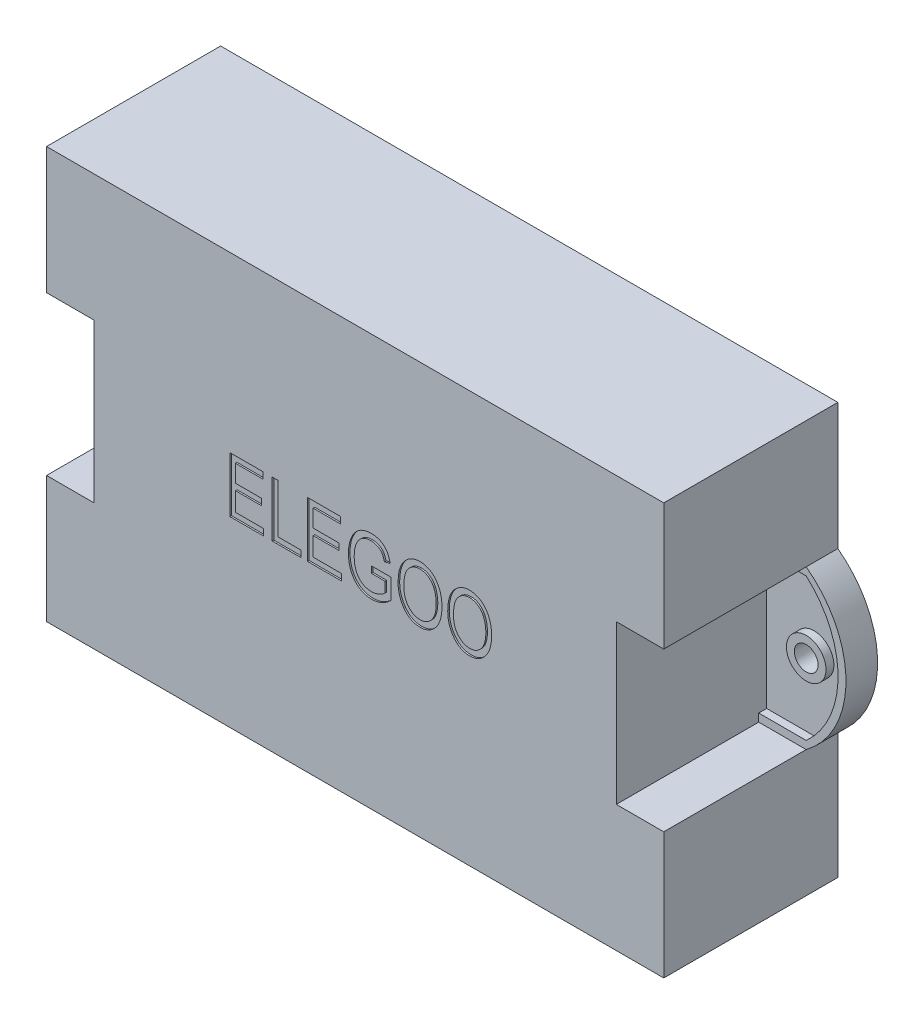
from build123d import *

# Parameters (mm, degrees)
BOSS_EXTRU_1_DEPTH      = 3
BOSS_EXTRU_2_DEPTH      = 19
ESQUISSE3_R             = 2.5
ESQUISSE3_R_2           = 1.5
BOSS_EXTRU_9_DEPTH      = 1
ENL_V_MAT_EXTRU_2_DEPTH = 0.2
ENL_V_START             = -10
ESQUISSE6_R             = 1.5
ENL_V_MAT_EXTRU_3_DEPTH = 10


with BuildPart() as part:
    # Esquisse1 → Boss.-Extru.1 (new body)
    with BuildSketch(Plane.XY):
        with BuildLine():
            Line((-2.21, 17.03), (36.79, 17.03))
            Line((36.79, 17.03), (36.79, 1.03))
            ThreePointArc((36.79, 1.03), (41.813713926, -8.97), (36.79, -18.97))
            Line((36.79, -18.97), (36.79, -34.97))
            Line((36.79, -34.97), (-2.21, -34.97))
            Line((-2.21, -34.97), (-2.21, 17.03))
        make_face()
    boss_extru_1 = extrude(amount=BOSS_EXTRU_1_DEPTH)

    # Esquisse2 → Boss.-Extru.2 (add)
    with BuildSketch(Plane.XY.offset(3)):
        Polygon((36.79, -18.97), (30.79, -18.97), (30.79, 1.03), (36.79, 1.03), (36.79, 17.03), (-2.21, 17.03), (-2.21, -34.97), (36.79, -34.97), align=None)
    boss_extru_2 = extrude(amount=BOSS_EXTRU_2_DEPTH)

    # Esquisse3 → Boss.-Extru.9 (add)
    # profile 1 of 4: a face of its own
    with BuildSketch(Plane.XY.offset(3)):
        with Locations(Location((36.79, -8.97, 0), (0, 0, 180))):
            Circle(ESQUISSE3_R)
        with Locations((36.79, -8.97)):
            Circle(ESQUISSE3_R_2, mode=Mode.SUBTRACT)
    # profile 2 of 4: a face of its own
    with BuildSketch(Plane.XY.offset(3)):
        with BuildLine():
            Line((36.787452184, 0.03), (36.79, 0.03))
            ThreePointArc((36.79, 0.03), (40.815412149, -8.97), (36.79, -17.97))
            ThreePointArc((36.79, -17.97), (36.165579804, -18.491619391), (35.507446563, -18.97))
            Line((35.507446563, -18.97), (36.79, -18.97))
            ThreePointArc((36.79, -18.97), (41.813713926, -8.97), (36.79, 1.03))
            Line((36.79, 1.03), (35.504415575, 1.03))
            ThreePointArc((35.504415575, 1.03), (36.162796738, 0.551635665), (36.787452184, 0.03))
        make_face()
    # profile 3 of 4: a face of its own
    with BuildSketch(Plane.XY.offset(3)):
        with BuildLine():
            Line((30.79, 0.03), (36.787452184, 0.03))
            ThreePointArc((36.787452184, 0.03), (36.162796738, 0.551635665), (35.504415575, 1.03))
            Line((35.504415575, 1.03), (30.79, 1.03))
            Line((30.79, 1.03), (30.79, 0.03))
        make_face()
    # profile 4 of 4: a face of its own
    with BuildSketch(Plane.XY.offset(3)):
        with BuildLine():
            ThreePointArc((35.507446563, -18.97), (36.165579804, -18.491619391), (36.79, -17.97))
            Line((36.79, -17.97), (30.79, -17.97))
            Line((30.79, -17.97), (30.79, -18.97))
            Line((30.79, -18.97), (35.507446563, -18.97))
        make_face()
    boss_extru_9 = extrude(amount=BOSS_EXTRU_9_DEPTH)

    # Symétrie6: Boss.-Extru.1, Boss.-Extru.2, Boss.-Extru.9 across plane
    add(boss_extru_1.mirror(Plane(origin=(-2.21, 17.03, 3), x_dir=(0, 0, 1), z_dir=(1, 0, 0))))
    add(boss_extru_2.mirror(Plane(origin=(-2.21, 17.03, 3), x_dir=(0, 0, 1), z_dir=(1, 0, 0))))
    add(boss_extru_9.mirror(Plane(origin=(-2.21, 17.03, 3), x_dir=(0, 0, 1), z_dir=(1, 0, 0))))

    # Esquisse5 → Enlèv. mat.-Extru.2 (cut)
    # profile 1 of 6: a face of its own
    with BuildSketch(Plane.XY.offset(22)):
        Polygon((-18.057289622, -11.88423704), (-18.057289622, -4.88423704), (-13.87547144, -4.88423704), (-13.87547144, -5.702418858), (-17.330016895, -5.702418858), (-17.330016895, -7.88423704), (-14.057289622, -7.88423704), (-14.057289622, -8.702418858), (-17.330016895, -8.702418858), (-17.330016895, -11.066055222), (-13.784562349, -11.066055222), (-13.784562349, -11.88423704), align=None)
    # profile 2 of 6: a face of its own
    with BuildSketch(Plane.XY.offset(22)):
        Polygon((-12.693653258, -11.88423704), (-12.693653258, -4.88423704), (-11.966380531, -4.88423704), (-11.966380531, -11.066055222), (-9.057289622, -11.066055222), (-9.057289622, -11.88423704), align=None)
    # profile 3 of 6: a face of its own
    with BuildSketch(Plane.XY.offset(22)):
        Polygon((-8.239107804, -11.88423704), (-8.239107804, -4.88423704), (-4.057289622, -4.88423704), (-4.057289622, -5.702418858), (-7.511835076, -5.702418858), (-7.511835076, -7.88423704), (-4.239107804, -7.88423704), (-4.239107804, -8.702418858), (-7.511835076, -8.702418858), (-7.511835076, -11.066055222), (-3.966380531, -11.066055222), (-3.966380531, -11.88423704), align=None)
    # profile 4 of 6: a face of its own
    with BuildSketch(Plane.XY.offset(22)):
        with BuildLine():
            Line((-0.148198713, -9.156964313), (-0.148198713, -8.338782495))
            Line((-0.148198713, -8.338782495), (2.306346742, -8.338782495))
            Line((2.306346742, -8.338782495), (2.306346742, -10.902702949))
            add(Edge.make_bspline(
                [(2.306346742, -10.902702949), (2.21300257, -10.987643456), (2.030313115, -11.153885596), (1.739146432, -11.370934521), (1.444357993, -11.557504236), (1.14436216, -11.709936828), (0.839698561, -11.829659821), (0.53056013, -11.913252649), (0.216713464, -11.96511629), (0.00587935, -11.971795131), (-0.099903258, -11.975146131)],
                knots=[0, 0, 0, 0, 1.121144615, 2.194259096, 3.22291754, 4.218514423, 5.180530362, 6.126881594, 7.060193117, 8, 8, 8, 8], degree=3))
            add(Edge.make_bspline(
                [(-0.099903258, -11.975146131), (-0.169536272, -11.973527736), (-0.307619034, -11.970318447), (-0.511864163, -11.952454353), (-0.710575738, -11.919079502), (-0.90334636, -11.873994202), (-1.090762489, -11.815972159), (-1.271184033, -11.742120304), (-1.447977622, -11.659583386), (-1.616998008, -11.560738038), (-1.778874063, -11.450128655), (-1.932538272, -11.32748953), (-2.078294042, -11.194071551), (-2.213497034, -11.046313577), (-2.340623064, -10.887499989), (-2.461282027, -10.718166162), (-2.569962832, -10.534819607), (-2.672745007, -10.341247482), (-2.763098293, -10.135595145), (-2.841610997, -9.919633851), (-2.907954727, -9.693704494), (-2.963609183, -9.457675354), (-3.006126384, -9.211471751), (-3.035147093, -8.955334293), (-3.054583881, -8.68946208), (-3.056377381, -8.50879928), (-3.057289622, -8.416907495)],
                knots=[0, 0, 0, 0, 0.963545397, 1.910717405, 2.833679837, 3.748938136, 4.648160849, 5.544707014, 6.44428759, 7.345417256, 8.250301349, 9.15471106, 10.063381295, 10.981308332, 11.922549023, 12.876762963, 13.855312354, 14.869185747, 15.907484256, 16.960251447, 18.046404778, 19.163470092, 20.313696906, 21.500864286, 22.728847097, 24, 24, 24, 24], degree=3))
            add(Edge.make_bspline(
                [(-3.057289622, -8.416907495), (-3.0563389, -8.323599773), (-3.054469284, -8.140108021), (-3.03552937, -7.86939845), (-3.004410478, -7.608229214), (-2.96155843, -7.356080422), (-2.908563947, -7.112305664), (-2.839727493, -6.878381683), (-2.76054674, -6.653391579), (-2.669185543, -6.438861868), (-2.56938221, -6.234986611), (-2.459628052, -6.044654666), (-2.343583151, -5.867294916), (-2.217577539, -5.705820135), (-2.087469543, -5.555138715), (-1.947683014, -5.420344366), (-1.801026771, -5.298408246), (-1.64537749, -5.192115003), (-1.483115941, -5.097817818), (-1.313193804, -5.017007743), (-1.136877019, -4.947053657), (-0.953274377, -4.889772592), (-0.762006493, -4.847906826), (-0.563754366, -4.816795561), (-0.358403504, -4.795764411), (-0.218800545, -4.794146288), (-0.148198713, -4.793327949)],
                knots=[0, 0, 0, 0, 1.283121513, 2.523287582, 3.730023389, 4.899079804, 6.039789461, 7.15880579, 8.250410031, 9.318392136, 10.363902253, 11.370311636, 12.338384822, 13.276198214, 14.185288112, 15.074093801, 15.943727649, 16.805327304, 17.663128848, 18.522362821, 19.39060582, 20.270106898, 21.164311373, 22.080741752, 23.02936765, 24, 24, 24, 24], degree=3))
            add(Edge.make_bspline(
                [(-0.148198713, -4.793327949), (-0.045283381, -4.795776313), (0.154920446, -4.800539177), (0.445181775, -4.84551072), (0.715918021, -4.918723992), (0.966092713, -5.023355588), (1.195751123, -5.154526409), (1.40483213, -5.310387596), (1.592759918, -5.490908465), (1.730187589, -5.662268133), (1.829793665, -5.812150157), (1.899797521, -5.935652101), (1.965023659, -6.068844112), (2.024292485, -6.212927103), (2.079596826, -6.36652883), (2.130926537, -6.529858713), (2.176116974, -6.703528333), (2.202126299, -6.823061155), (2.215437651, -6.88423704)],
                knots=[0, 0, 0, 0, 1.421442541, 2.765168547, 4.047841273, 5.288586259, 6.501956771, 7.694182091, 8.88353085, 10.093491299, 10.721426975, 11.369099503, 12.053886711, 12.769643166, 13.521004755, 14.309514717, 15.134823968, 16, 16, 16, 16], degree=3))
            Line((2.215437651, -6.88423704), (1.488164924, -7.066055222))
            add(Edge.make_bspline(
                [(1.488164924, -7.066055222), (1.46442036, -6.976640385), (1.419717269, -6.808302078), (1.336235163, -6.576358898), (1.243285071, -6.380220902), (1.13936397, -6.215815777), (1.019965564, -6.078957899), (0.887718056, -5.957837581), (0.735029327, -5.856586003), (0.569280307, -5.767495338), (0.388487805, -5.699052173), (0.197039457, -5.646895316), (-0.006160171, -5.617020224), (-0.14526217, -5.613373976), (-0.216380531, -5.611509767)],
                knots=[0, 0, 0, 0, 1.35370667, 2.548578037, 3.602482135, 4.525244969, 5.385205021, 6.25372376, 7.141792941, 8.059466754, 9.00287123, 9.96447941, 10.959304047, 12, 12, 12, 12], degree=3))
            add(Edge.make_bspline(
                [(-0.216380531, -5.611509767), (-0.268497866, -5.612192827), (-0.371041604, -5.613536786), (-0.522442663, -5.628221931), (-0.668121475, -5.652089702), (-0.80839528, -5.685420774), (-0.943641137, -5.725175032), (-1.071936795, -5.779325054), (-1.19562128, -5.839916976), (-1.314161536, -5.909761034), (-1.427227206, -5.989524761), (-1.533480115, -6.081039823), (-1.634825128, -6.181615545), (-1.728752777, -6.294446187), (-1.819826363, -6.415380582), (-1.903293487, -6.548470673), (-1.981905501, -6.691055418), (-2.053685104, -6.843945953), (-2.119514445, -7.006295157), (-2.17615102, -7.177554564), (-2.222441291, -7.358155359), (-2.263045902, -7.546521034), (-2.291518544, -7.744567756), (-2.315262325, -7.950982154), (-2.327491501, -8.166284158), (-2.3291665, -8.312728382), (-2.330016895, -8.387077949)],
                knots=[0, 0, 0, 0, 0.95244652, 1.873991161, 2.777557121, 3.648832578, 4.508552549, 5.350797697, 6.190771618, 7.02501797, 7.86316154, 8.7165405, 9.585620601, 10.469996113, 11.397859992, 12.351132043, 13.338946381, 14.372712626, 15.436726846, 16.539770861, 17.66713286, 18.84353329, 20.060284837, 21.322933361, 22.640856277, 24, 24, 24, 24], degree=3))
            add(Edge.make_bspline(
                [(-2.330016895, -8.387077949), (-2.328136817, -8.498886647), (-2.324489742, -8.715779215), (-2.295613566, -9.030379425), (-2.249941993, -9.324083371), (-2.183408028, -9.595945586), (-2.098226228, -9.846193615), (-1.994742529, -10.0752961), (-1.871065463, -10.282378689), (-1.728009263, -10.466590072), (-1.569888067, -10.6285446), (-1.400107307, -10.770162671), (-1.219087033, -10.89074088), (-1.025283979, -10.987195561), (-0.821542826, -11.065000369), (-0.605524153, -11.118715594), (-0.378287201, -11.150021741), (-0.223107845, -11.154618901), (-0.143937349, -11.156964313)],
                knots=[0, 0, 0, 0, 1.344305217, 2.607756079, 3.795613497, 4.915552292, 5.968887625, 6.970219091, 7.933010886, 8.862341374, 9.768284732, 10.649651063, 11.516609893, 12.377263757, 13.247581458, 14.134137142, 15.048060964, 16, 16, 16, 16], degree=3))
            add(Edge.make_bspline(
                [(-0.143937349, -11.156964313), (-0.066128414, -11.154509321), (0.091898038, -11.149523343), (0.329600595, -11.107887479), (0.5694829, -11.040213531), (0.80680626, -10.94896093), (1.033007404, -10.839870557), (1.240275478, -10.719879094), (1.422358248, -10.588001941), (1.527920826, -10.489019721), (1.579074014, -10.441055222)],
                knots=[0, 0, 0, 0, 0.978162575, 1.986604247, 3.025534994, 4.109442341, 5.180230685, 6.181206173, 7.118654505, 8, 8, 8, 8], degree=3))
            Line((1.579074014, -10.441055222), (1.579074014, -9.156964313))
            Line((1.579074014, -9.156964313), (-0.148198713, -9.156964313))
        make_face()
    # profile 5 of 6: a face of its own
    with BuildSketch(Plane.XY.offset(22)):
        with BuildLine():
            add(Edge.make_bspline(
                [(3.215437651, -8.476566586), (3.217910165, -8.333024977), (3.222725063, -8.053496509), (3.259427471, -7.647087379), (3.32177376, -7.266377491), (3.407401524, -6.911001388), (3.519907409, -6.581598076), (3.655946674, -6.276888697), (3.818456683, -5.998292282), (4.005061641, -5.747030271), (4.208615654, -5.522642534), (4.427731849, -5.328159251), (4.657796505, -5.161844052), (4.901661464, -5.028081377), (5.156186856, -4.920482762), (5.424931263, -4.8484657), (5.704710705, -4.800322072), (5.895628544, -4.795681021), (5.992426287, -4.793327949)],
                knots=[0, 0, 0, 0, 1.331070849, 2.592086014, 3.780305682, 4.906005075, 5.978011684, 7.003908552, 7.995748348, 8.962674125, 9.901370513, 10.800246893, 11.675154716, 12.528146756, 13.374603752, 14.231114787, 15.103152967, 16, 16, 16, 16], degree=3))
            add(Edge.make_bspline(
                [(5.992426287, -4.793327949), (6.055931242, -4.794734119), (6.181358621, -4.797511416), (6.367364305, -4.818425806), (6.549054767, -4.850037367), (6.726271246, -4.898131029), (6.899983232, -4.957212049), (7.068897623, -5.031321662), (7.23312986, -5.119033911), (7.39334884, -5.217560002), (7.547097983, -5.330296976), (7.693178739, -5.455315391), (7.831801207, -5.592102373), (7.960755104, -5.741739119), (8.082189124, -5.902803486), (8.194079601, -6.076407114), (8.297956483, -6.262116502), (8.394283406, -6.458686368), (8.480981619, -6.666290394), (8.556755662, -6.883819993), (8.618162206, -7.112049729), (8.671634336, -7.348742497), (8.710333861, -7.59610897), (8.740789359, -7.852349909), (8.757641931, -8.118857477), (8.759796242, -8.299461408), (8.760892196, -8.391339313)],
                knots=[0, 0, 0, 0, 0.899824171, 1.777224896, 2.649917024, 3.510973429, 4.376801712, 5.248254587, 6.121797682, 7.013780974, 7.911701495, 8.820786024, 9.736582303, 10.668970754, 11.617827344, 12.593151753, 13.593637019, 14.632021419, 15.69381936, 16.780371356, 17.893899404, 19.04171746, 20.217729733, 21.440466177, 22.69789874, 24, 24, 24, 24], degree=3))
            add(Edge.make_bspline(
                [(8.760892196, -8.391339313), (8.758606633, -8.516870889), (8.754131002, -8.762689009), (8.722175887, -9.12273036), (8.664064309, -9.464479795), (8.589349413, -9.789685079), (8.487601563, -10.095800646), (8.36510406, -10.384373709), (8.221399493, -10.656231282), (8.105418952, -10.82281822), (8.047824014, -10.905543858)],
                knots=[0, 0, 0, 0, 1.133525988, 2.219690354, 3.25996653, 4.261750254, 5.229810789, 6.168477289, 7.090481605, 8, 8, 8, 8], degree=3))
            add(Edge.make_bspline(
                [(8.047824014, -10.905543858), (7.981382963, -10.990370358), (7.851516031, -11.156173836), (7.630629117, -11.375395424), (7.394462766, -11.560518961), (7.143437467, -11.713989637), (6.875813992, -11.830226703), (6.59372064, -11.914873457), (6.295849476, -11.965449717), (6.092053395, -11.971872175), (5.988164924, -11.975146131)],
                knots=[0, 0, 0, 0, 1.070119256, 2.09167529, 3.083880958, 4.046692552, 5.007570185, 5.975302747, 6.967876608, 8, 8, 8, 8], degree=3))
            add(Edge.make_bspline(
                [(5.988164924, -11.975146131), (5.883788629, -11.971986493), (5.678943969, -11.965785517), (5.379084895, -11.913427747), (5.095447626, -11.826448021), (4.826501568, -11.706492901), (4.574980598, -11.549803969), (4.339519707, -11.35896551), (4.118621079, -11.134917034), (3.990059294, -10.96441839), (3.924244469, -10.877134767)],
                knots=[0, 0, 0, 0, 1.027712946, 2.016947528, 2.987811303, 3.944031492, 4.90967079, 5.89821231, 6.924028725, 8, 8, 8, 8], degree=3))
            add(Edge.make_bspline(
                [(3.924244469, -10.877134767), (3.86731085, -10.792852331), (3.75378061, -10.624786339), (3.610562642, -10.355017453), (3.487717265, -10.073632921), (3.388998265, -9.778613874), (3.309891613, -9.471675699), (3.25524643, -9.151462704), (3.222056267, -8.818179936), (3.217668335, -8.591701133), (3.215437651, -8.476566586)],
                knots=[0, 0, 0, 0, 0.958933014, 1.912189966, 2.876424288, 3.85247362, 4.843745406, 5.863745303, 6.913996742, 8, 8, 8, 8], degree=3))
        make_face()
        with BuildLine():
            add(Edge.make_bspline(
                [(3.942710378, -8.487930222), (3.944775287, -8.590730963), (3.948788789, -8.790541674), (3.975353752, -9.081692137), (4.022059781, -9.355252407), (4.087412702, -9.611196278), (4.168821969, -9.850273391), (4.272057335, -10.070279513), (4.393023092, -10.273305445), (4.532074511, -10.457740385), (4.685016557, -10.621232365), (4.845810859, -10.765280107), (5.016470893, -10.884574133), (5.192940154, -10.985715379), (5.379090544, -11.062988769), (5.573383008, -11.116433507), (5.775330002, -11.150442972), (5.912744566, -11.154768889), (5.982483105, -11.156964313)],
                knots=[0, 0, 0, 0, 1.312267352, 2.550614609, 3.728111592, 4.851026838, 5.919546711, 6.947055793, 7.94734328, 8.931337301, 9.889295514, 10.801324679, 11.681722049, 12.542374657, 13.393208477, 14.246700222, 15.110192087, 16, 16, 16, 16], degree=3))
            add(Edge.make_bspline(
                [(5.982483105, -11.156964313), (6.053627406, -11.154700048), (6.194305513, -11.150222775), (6.400788889, -11.117083459), (6.598397907, -11.061873973), (6.78604832, -10.98212466), (6.965564507, -10.882841852), (7.136071435, -10.76069969), (7.296960837, -10.615938391), (7.448983734, -10.450344835), (7.586634945, -10.262271003), (7.708461041, -10.053918691), (7.808997154, -9.823291044), (7.890411341, -9.572281953), (7.956663858, -9.301369927), (8.000084492, -9.00892723), (8.029957024, -8.696411033), (8.032375321, -8.480904646), (8.033619469, -8.370032495)],
                knots=[0, 0, 0, 0, 0.878770405, 1.737648083, 2.57658969, 3.407764765, 4.250999223, 5.106523145, 5.993164277, 6.920704469, 7.879005581, 8.867335561, 9.896730148, 10.980825599, 12.124467321, 13.338272289, 14.63061378, 16, 16, 16, 16], degree=3))
            add(Edge.make_bspline(
                [(8.033619469, -8.370032495), (8.03292533, -8.29709369), (8.031558207, -8.153438882), (8.016981213, -7.940562772), (7.99254381, -7.734028076), (7.961045616, -7.532584272), (7.915404349, -7.338391291), (7.865722432, -7.148427249), (7.802701782, -6.965246378), (7.753895209, -6.84660268), (7.729642196, -6.787646131)],
                knots=[0, 0, 0, 0, 1.078644903, 2.124418214, 3.153743212, 4.154196665, 5.137842886, 6.102739285, 7.057211248, 8, 8, 8, 8], degree=3))
            add(Edge.make_bspline(
                [(7.729642196, -6.787646131), (7.688660008, -6.701418159), (7.607673031, -6.531018699), (7.44209507, -6.302997209), (7.250424868, -6.099259803), (7.029134899, -5.928386812), (6.79037679, -5.786674968), (6.536251076, -5.684622649), (6.270480193, -5.622774709), (6.089341449, -5.615283055), (5.998108105, -5.611509767)],
                knots=[0, 0, 0, 0, 1.032714874, 2.040800129, 3.038924044, 4.055125724, 5.060150422, 6.038733642, 7.012177711, 8, 8, 8, 8], degree=3))
            add(Edge.make_bspline(
                [(5.998108105, -5.611509767), (5.925076468, -5.613772302), (5.781111754, -5.618232357), (5.570300552, -5.651107946), (5.369779269, -5.706923571), (5.179387267, -5.784542749), (4.997855357, -5.882244865), (4.82763148, -6.005123718), (4.666963545, -6.148712273), (4.5173841, -6.314731601), (4.379374553, -6.501871149), (4.264058392, -6.716748315), (4.162297166, -6.952402068), (4.082544543, -7.213783361), (4.018016971, -7.498022161), (3.976654333, -7.807081465), (3.946117743, -8.139311415), (3.943872732, -8.36900591), (3.942710378, -8.487930222)],
                knots=[0, 0, 0, 0, 0.879508816, 1.733744975, 2.562624688, 3.381316754, 4.205651284, 5.039714663, 5.904114686, 6.796492674, 7.727389142, 8.697387403, 9.727116746, 10.814853576, 11.984051762, 13.234256004, 14.568036196, 16, 16, 16, 16], degree=3))
        make_face(mode=Mode.SUBTRACT)
    # profile 6 of 6: a face of its own
    with BuildSketch(Plane.XY.offset(22)):
        with BuildLine():
            add(Edge.make_bspline(
                [(9.488164924, -8.476566586), (9.490637438, -8.333024977), (9.495452336, -8.053496509), (9.532154744, -7.647087379), (9.594501033, -7.266377491), (9.680128797, -6.911001388), (9.792634682, -6.581598076), (9.928673947, -6.276888697), (10.091183956, -5.998292282), (10.277788913, -5.747030271), (10.481342926, -5.522642534), (10.700459122, -5.328159251), (10.930523778, -5.161844052), (11.174388737, -5.028081377), (11.428914128, -4.920482762), (11.697658535, -4.8484657), (11.977437978, -4.800322072), (12.168355816, -4.795681021), (12.26515356, -4.793327949)],
                knots=[0, 0, 0, 0, 1.331070849, 2.592086014, 3.780305682, 4.906005075, 5.978011684, 7.003908552, 7.995748348, 8.962674125, 9.901370513, 10.800246893, 11.675154716, 12.528146756, 13.374603752, 14.231114787, 15.103152967, 16, 16, 16, 16], degree=3))
            add(Edge.make_bspline(
                [(12.26515356, -4.793327949), (12.328658515, -4.794734119), (12.454085894, -4.797511416), (12.640091578, -4.818425806), (12.821782039, -4.850037367), (12.998998519, -4.898131029), (13.172710505, -4.957212049), (13.341624895, -5.031321662), (13.505857133, -5.119033911), (13.666076113, -5.217560002), (13.819825256, -5.330296976), (13.965906011, -5.455315391), (14.10452848, -5.592102373), (14.233482377, -5.741739119), (14.354916396, -5.902803486), (14.466806873, -6.076407114), (14.570683756, -6.262116502), (14.667010679, -6.458686368), (14.753708892, -6.666290394), (14.829482935, -6.883819993), (14.890889478, -7.112049729), (14.944361609, -7.348742497), (14.983061134, -7.59610897), (15.013516631, -7.852349909), (15.030369204, -8.118857477), (15.032523515, -8.299461408), (15.033619469, -8.391339313)],
                knots=[0, 0, 0, 0, 0.899824171, 1.777224896, 2.649917024, 3.510973429, 4.376801712, 5.248254587, 6.121797682, 7.013780974, 7.911701495, 8.820786024, 9.736582303, 10.668970754, 11.617827344, 12.593151753, 13.593637019, 14.632021419, 15.69381936, 16.780371356, 17.893899404, 19.04171746, 20.217729733, 21.440466177, 22.69789874, 24, 24, 24, 24], degree=3))
            add(Edge.make_bspline(
                [(15.033619469, -8.391339313), (15.031333905, -8.516870889), (15.026858275, -8.762689009), (14.99490316, -9.12273036), (14.936791582, -9.464479795), (14.862076685, -9.789685079), (14.760328836, -10.095800646), (14.637831333, -10.384373709), (14.494126766, -10.656231282), (14.378146225, -10.82281822), (14.320551287, -10.905543858)],
                knots=[0, 0, 0, 0, 1.133525988, 2.219690354, 3.25996653, 4.261750254, 5.229810789, 6.168477289, 7.090481605, 8, 8, 8, 8], degree=3))
            add(Edge.make_bspline(
                [(14.320551287, -10.905543858), (14.254110236, -10.990370358), (14.124243303, -11.156173836), (13.90335639, -11.375395424), (13.667190039, -11.560518961), (13.41616474, -11.713989637), (13.148541264, -11.830226703), (12.866447913, -11.914873457), (12.568576749, -11.965449717), (12.364780668, -11.971872175), (12.260892196, -11.975146131)],
                knots=[0, 0, 0, 0, 1.070119256, 2.09167529, 3.083880958, 4.046692552, 5.007570185, 5.975302747, 6.967876608, 8, 8, 8, 8], degree=3))
            add(Edge.make_bspline(
                [(12.260892196, -11.975146131), (12.156515902, -11.971986493), (11.951671242, -11.965785517), (11.651812168, -11.913427747), (11.368174899, -11.826448021), (11.099228841, -11.706492901), (10.847707871, -11.549803969), (10.61224698, -11.35896551), (10.391348352, -11.134917034), (10.262786566, -10.96441839), (10.196971742, -10.877134767)],
                knots=[0, 0, 0, 0, 1.027712946, 2.016947528, 2.987811303, 3.944031492, 4.90967079, 5.89821231, 6.924028725, 8, 8, 8, 8], degree=3))
            add(Edge.make_bspline(
                [(10.196971742, -10.877134767), (10.140038123, -10.792852331), (10.026507883, -10.624786339), (9.883289915, -10.355017453), (9.760444537, -10.073632921), (9.661725538, -9.778613874), (9.582618885, -9.471675699), (9.527973703, -9.151462704), (9.49478354, -8.818179936), (9.490395607, -8.591701133), (9.488164924, -8.476566586)],
                knots=[0, 0, 0, 0, 0.958933014, 1.912189966, 2.876424288, 3.85247362, 4.843745406, 5.863745303, 6.913996742, 8, 8, 8, 8], degree=3))
        make_face()
        with BuildLine():
            add(Edge.make_bspline(
                [(10.215437651, -8.487930222), (10.21750256, -8.590730963), (10.221516061, -8.790541674), (10.248081024, -9.081692137), (10.294787054, -9.355252407), (10.360139975, -9.611196278), (10.441549242, -9.850273391), (10.544784607, -10.070279513), (10.665750365, -10.273305445), (10.804801783, -10.457740385), (10.95774383, -10.621232365), (11.118538131, -10.765280107), (11.289198166, -10.884574133), (11.465667426, -10.985715379), (11.651817817, -11.062988769), (11.846110281, -11.116433507), (12.048057275, -11.150442972), (12.185471838, -11.154768889), (12.255210378, -11.156964313)],
                knots=[0, 0, 0, 0, 1.312267352, 2.550614609, 3.728111592, 4.851026838, 5.919546711, 6.947055793, 7.94734328, 8.931337301, 9.889295514, 10.801324679, 11.681722049, 12.542374657, 13.393208477, 14.246700222, 15.110192087, 16, 16, 16, 16], degree=3))
            add(Edge.make_bspline(
                [(12.255210378, -11.156964313), (12.326354678, -11.154700048), (12.467032786, -11.150222775), (12.673516161, -11.117083459), (12.87112518, -11.061873973), (13.058775592, -10.98212466), (13.23829178, -10.882841852), (13.408798707, -10.76069969), (13.56968811, -10.615938391), (13.721711006, -10.450344835), (13.859362218, -10.262271003), (13.981188313, -10.053918691), (14.081724426, -9.823291044), (14.163138614, -9.572281953), (14.229391131, -9.301369927), (14.272811765, -9.00892723), (14.302684296, -8.696411033), (14.305102594, -8.480904646), (14.306346742, -8.370032495)],
                knots=[0, 0, 0, 0, 0.878770405, 1.737648083, 2.57658969, 3.407764765, 4.250999223, 5.106523145, 5.993164277, 6.920704469, 7.879005581, 8.867335561, 9.896730148, 10.980825599, 12.124467321, 13.338272289, 14.63061378, 16, 16, 16, 16], degree=3))
            add(Edge.make_bspline(
                [(14.306346742, -8.370032495), (14.305652603, -8.29709369), (14.30428548, -8.153438882), (14.289708485, -7.940562772), (14.265271083, -7.734028076), (14.233772889, -7.532584272), (14.188131621, -7.338391291), (14.138449704, -7.148427249), (14.075429055, -6.965246378), (14.026622482, -6.84660268), (14.002369469, -6.787646131)],
                knots=[0, 0, 0, 0, 1.078644903, 2.124418214, 3.153743212, 4.154196665, 5.137842886, 6.102739285, 7.057211248, 8, 8, 8, 8], degree=3))
            add(Edge.make_bspline(
                [(14.002369469, -6.787646131), (13.96138728, -6.701418159), (13.880400303, -6.531018699), (13.714822342, -6.302997209), (13.523152141, -6.099259803), (13.301862172, -5.928386812), (13.063104063, -5.786674968), (12.808978349, -5.684622649), (12.543207465, -5.622774709), (12.362068722, -5.615283055), (12.270835378, -5.611509767)],
                knots=[0, 0, 0, 0, 1.032714874, 2.040800129, 3.038924044, 4.055125724, 5.060150422, 6.038733642, 7.012177711, 8, 8, 8, 8], degree=3))
            add(Edge.make_bspline(
                [(12.270835378, -5.611509767), (12.19780374, -5.613772302), (12.053839027, -5.618232357), (11.843027824, -5.651107946), (11.642506542, -5.706923571), (11.45211454, -5.784542749), (11.27058263, -5.882244865), (11.100358753, -6.005123718), (10.939690818, -6.148712273), (10.790111373, -6.314731601), (10.652101826, -6.501871149), (10.536785665, -6.716748315), (10.435024439, -6.952402068), (10.355271816, -7.213783361), (10.290744244, -7.498022161), (10.249381605, -7.807081465), (10.218845015, -8.139311415), (10.216600005, -8.36900591), (10.215437651, -8.487930222)],
                knots=[0, 0, 0, 0, 0.879508816, 1.733744975, 2.562624688, 3.381316754, 4.205651284, 5.039714663, 5.904114686, 6.796492674, 7.727389142, 8.697387403, 9.727116746, 10.814853576, 11.984051762, 13.234256004, 14.568036196, 16, 16, 16, 16], degree=3))
        make_face(mode=Mode.SUBTRACT)
    extrude(amount=-ENL_V_MAT_EXTRU_2_DEPTH, mode=Mode.SUBTRACT)

    # Esquisse6 → Enlèv. mat.-Extru.3 (cut)
    with BuildSketch(Plane.XY.offset(3).offset(ENL_V_START)):
        with Locations(Location((36.79, -8.97, 0), (0, 0, 180))):
            Circle(ESQUISSE6_R)
        with Locations(Location((-41.21, -8.97, 0), (0, 0, 180))):
            Circle(ESQUISSE6_R)
    extrude(amount=ENL_V_MAT_EXTRU_3_DEPTH, mode=Mode.SUBTRACT)


solid = part.part
